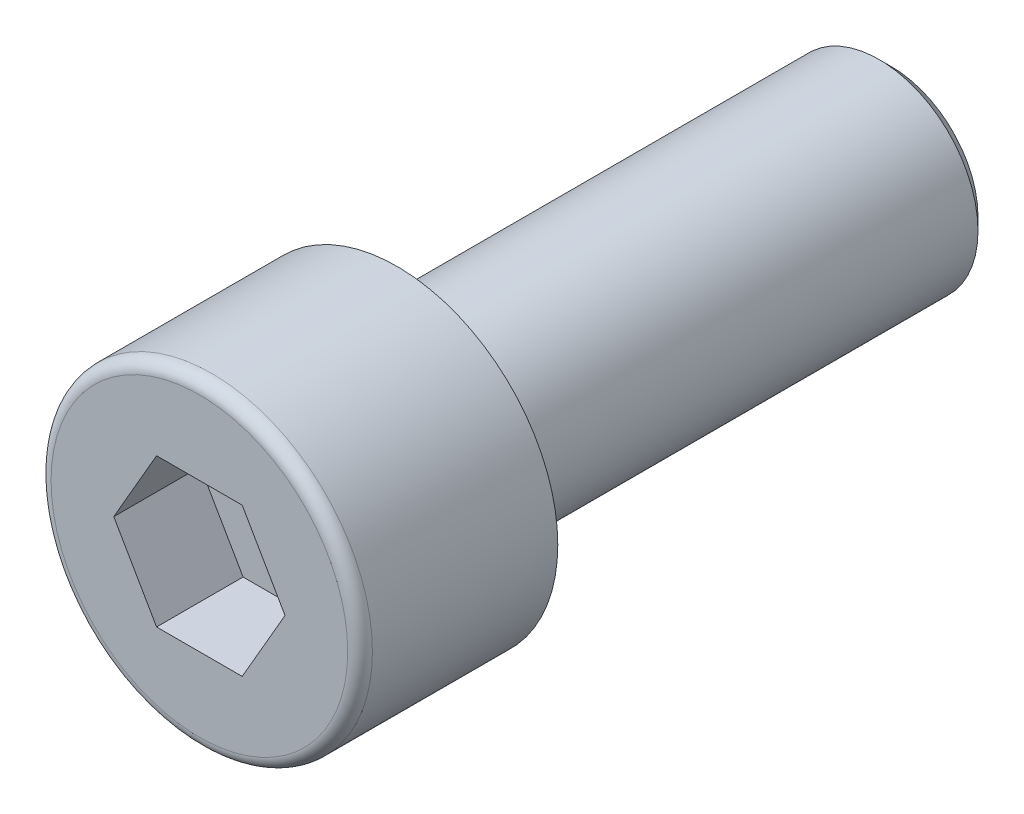
from build123d import *

# Parameters (mm, degrees)
ESQUISSE1_R             = 4
BASE_EXTRUSION_DEPTH    = 20
ESQUISSE2_R             = 6.5
BOSS_EXTRU_1_DEPTH      = 8
ENL_V_MAT_EXTRU_1_DEPTH = 3.5
CONG_2_R                = 0.5
CHANFREIN1_SIZE         = 0.5


with BuildPart() as part:
    # Esquisse1 → Base-Extrusion (new body)
    with BuildSketch(Plane.XY):
        Circle(ESQUISSE1_R)
    extrude(amount=BASE_EXTRUSION_DEPTH)

    # Esquisse2 → Boss.-Extru.1 (add)
    with BuildSketch(Plane.XY.offset(20)):
        Circle(ESQUISSE2_R)
    extrude(amount=BOSS_EXTRU_1_DEPTH)

    # Esquisse3 → Enlèv. mat.-Extru.1 (cut)
    with BuildSketch(Plane.XY.offset(28)):
        Polygon((-1.732050808, 3), (1.732050808, 3), (3.464101615, 0), (1.732050808, -3), (-1.732050808, -3), (-3.464101615, 0), align=None)
    extrude(amount=-ENL_V_MAT_EXTRU_1_DEPTH, mode=Mode.SUBTRACT)

    # Congé2
    cong_2_edges = [part.edges().sort_by_distance(p)[0] for p in [
        (-6.5, 0, 28),
    ]]
    fillet(cong_2_edges, radius=CONG_2_R)

    # Chanfrein1
    chanfrein1_edges = [part.edges().sort_by_distance(p)[0] for p in [
        (-4, 0, 0),
    ]]
    chamfer(chanfrein1_edges, length=CHANFREIN1_SIZE)


solid = part.part
